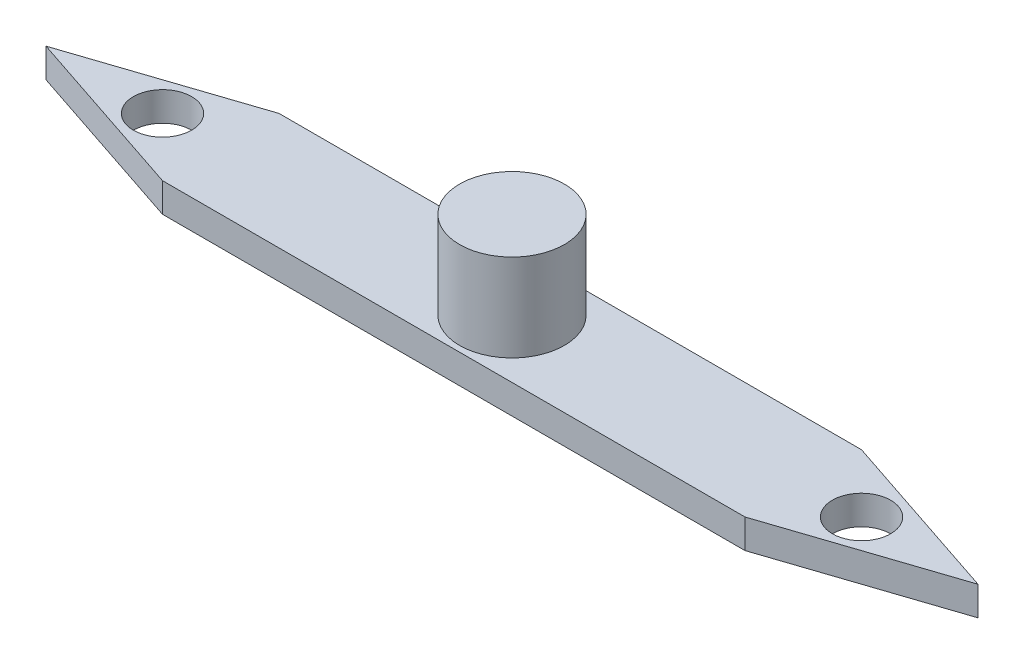
from build123d import *

# Parameters (mm, degrees)
BOSS_EXTRUDE1_DEPTH = 5
SKETCH3_R           = 9
BOSS_EXTRUDE2_DEPTH = 15
SKETCH5_R           = 5
CUT_EXTRUDE1_DEPTH  = 15


with BuildPart() as part:
    # Sketch1 → Boss-Extrude1 (new body)
    with BuildSketch(Plane(origin=(0, 0, 0), x_dir=(1, 0, 0), z_dir=(0, 1, 0))):
        Polygon((-50, 10), (50, 10), (80, 0), (50, -10), (-50, -10), (-80, 0), align=None)
    extrude(amount=BOSS_EXTRUDE1_DEPTH)

    # Sketch3 → Boss-Extrude2 (add)
    with BuildSketch(Plane(origin=(0, 5, 0), x_dir=(1, 0, 0), z_dir=(0, 1, 0))):
        with Locations(Location((0, 0, 0), (0, 0, 270))):
            Circle(SKETCH3_R)
    extrude(amount=BOSS_EXTRUDE2_DEPTH)

    # Sketch5 → Cut-Extrude1 (cut)
    with BuildSketch(Plane(origin=(0, 5, 0), x_dir=(1, 0, 0), z_dir=(0, 1, 0))):
        with Locations(Location((60, 0, 0), (0, 0, 270))):
            Circle(SKETCH5_R)
        with Locations(Location((-60, 0, 0), (0, 0, 270))):
            Circle(SKETCH5_R)
    extrude(amount=-CUT_EXTRUDE1_DEPTH, mode=Mode.SUBTRACT)


solid = part.part
